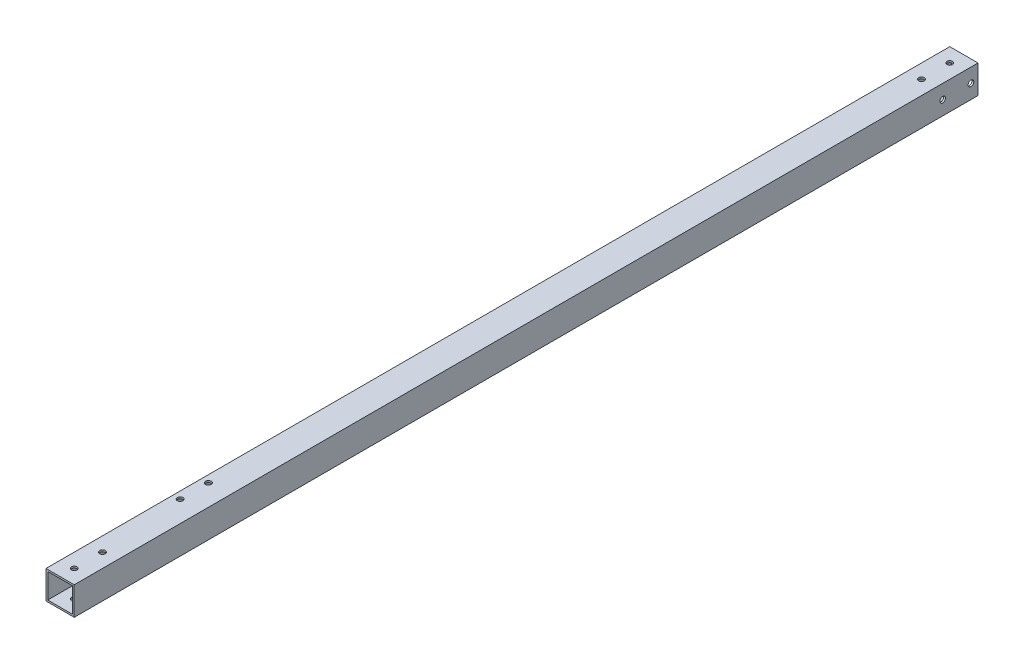
from build123d import *

# Parameters (mm, degrees)
SKETCH1_W           = 25.4
SKETCH1_H           = 25.4
SKETCH1_W_2         = 22.225
SKETCH1_H_2         = 22.225
BOSS_EXTRUDE1_DEPTH = 812.8
SKETCH3_R           = 2.54
CUT_EXTRUDE2_DEPTH  = 814.593362805
CUT_EXTRUDE3_REACH  = 815.593
SKETCH4_R           = 2.54
CUT_EXTRUDE4_REACH  = 815.593
SKETCH5_R           = 2.54


with BuildPart() as part:
    # Sketch1 → Boss-Extrude1 (new body)
    with BuildSketch(Plane.XY):
        with Locations((12.7, 12.7)):
            Rectangle(SKETCH1_W, SKETCH1_H)
        with Locations((12.7, 12.7)):
            Rectangle(SKETCH1_W_2, SKETCH1_H_2, mode=Mode.SUBTRACT)
    extrude(amount=BOSS_EXTRUDE1_DEPTH)

    # Sketch3 → Cut-Extrude2 (cut, through all)
    with BuildSketch(Plane(origin=(0, 25.4, 0), x_dir=(1, 0, 0), z_dir=(0, 1, 0))):
        with Locations(Location((12.7, -12.7, 0), (0, 0, 270))):
            Circle(SKETCH3_R)
        with Locations(Location((12.7, -38.1, 0), (0, 0, 270))):
            Circle(SKETCH3_R)
        with Locations(Location((12.7, -774.7, 0), (0, 0, 90))):
            Circle(SKETCH3_R)
        with Locations(Location((12.7, -800.1, 0), (0, 0, 90))):
            Circle(SKETCH3_R)
        with Locations(Location((6.35, -698.5, 0), (0, 0, 270))):
            Circle(SKETCH3_R)
        with Locations(Location((6.35, -673.1, 0), (0, 0, 270))):
            Circle(SKETCH3_R)
    extrude(amount=-CUT_EXTRUDE2_DEPTH, mode=Mode.SUBTRACT)

    # Sketch4 → Cut-Extrude3 (cut, up to next)
    with BuildSketch(Plane(origin=(25.4, 0, 0), x_dir=(0, 0, -1), z_dir=(1, 0, 0)), mode=Mode.PRIVATE) as cut_extrude3_sk1:
        with Locations((-6.35, 12.7)):
            Circle(SKETCH4_R)
    cut_extrude3_tool1 = extrude(cut_extrude3_sk1.sketch, amount=-CUT_EXTRUDE3_REACH, mode=Mode.PRIVATE) & part.part
    # Sketch4 → Cut-Extrude3 (cut, up to next)
    with BuildSketch(Plane(origin=(25.4, 0, 0), x_dir=(0, 0, -1), z_dir=(1, 0, 0)), mode=Mode.PRIVATE) as cut_extrude3_sk2:
        with Locations((-31.75, 12.7)):
            Circle(SKETCH4_R)
    cut_extrude3_tool2 = extrude(cut_extrude3_sk2.sketch, amount=-CUT_EXTRUDE3_REACH, mode=Mode.PRIVATE) & part.part
    add(cut_extrude3_tool1.solids().sort_by_distance((25.4, 12.7, 6.35))[0], mode=Mode.SUBTRACT)
    add(cut_extrude3_tool2.solids().sort_by_distance((25.4, 12.7, 31.75))[0], mode=Mode.SUBTRACT)

    # Sketch5 → Cut-Extrude4 (cut, up to next)
    with BuildSketch(Plane.ZY, mode=Mode.PRIVATE) as cut_extrude4_sk1:
        with Locations((39.6875, 12.7)):
            Circle(SKETCH5_R)
    cut_extrude4_tool1 = extrude(cut_extrude4_sk1.sketch, amount=-CUT_EXTRUDE4_REACH, mode=Mode.PRIVATE) & part.part
    # Sketch5 → Cut-Extrude4 (cut, up to next)
    with BuildSketch(Plane.ZY, mode=Mode.PRIVATE) as cut_extrude4_sk2:
        with Locations((730.25, 12.7)):
            Circle(SKETCH5_R)
    cut_extrude4_tool2 = extrude(cut_extrude4_sk2.sketch, amount=-CUT_EXTRUDE4_REACH, mode=Mode.PRIVATE) & part.part
    # Sketch5 → Cut-Extrude4 (cut, up to next)
    with BuildSketch(Plane.ZY, mode=Mode.PRIVATE) as cut_extrude4_sk3:
        with Locations((755.65, 12.7)):
            Circle(SKETCH5_R)
    cut_extrude4_tool3 = extrude(cut_extrude4_sk3.sketch, amount=-CUT_EXTRUDE4_REACH, mode=Mode.PRIVATE) & part.part
    add(cut_extrude4_tool1.solids().sort_by_distance((0, 12.7, 39.6875))[0], mode=Mode.SUBTRACT)
    add(cut_extrude4_tool2.solids().sort_by_distance((0, 12.7, 730.25))[0], mode=Mode.SUBTRACT)
    add(cut_extrude4_tool3.solids().sort_by_distance((0, 12.7, 755.65))[0], mode=Mode.SUBTRACT)


solid = part.part
